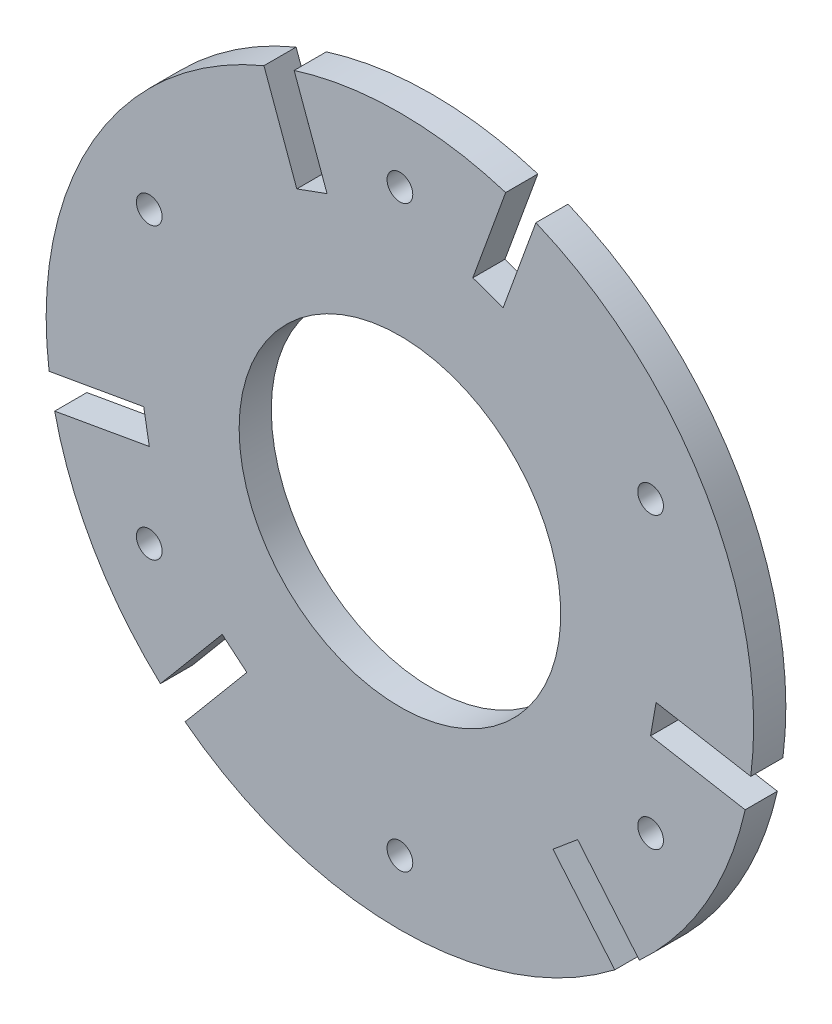
from build123d import *

# Parameters (mm, degrees)
CROQUIS1_R              = 55
SALIENTE_EXTRUIR1_DEPTH = 5
CORTAR_EXTRUIR1_DEPTH   = 78.942286341
CROQUIS3_R              = 2
CORTAR_EXTRUIR2_DEPTH   = 10
CROQUIS4_R              = 25
CORTAR_EXTRUIR3_DEPTH   = 78.942286341


with BuildPart() as part:
    # Croquis1 → Saliente-Extruir1 (new body)
    with BuildSketch(Plane.XY):
        Circle(CROQUIS1_R)
    extrude(amount=SALIENTE_EXTRUIR1_DEPTH)

    # Croquis2 → Cortar-Extruir1 (cut, through all)
    with BuildSketch(Plane.XY.offset(5)):
        Polygon((-21.161601507, 50.8315113), (-16.031299357, 36.736121988), (-11.332836253, 38.446222705), (-16.463138403, 52.541612016), align=None)
        Polygon((16.031299357, 36.736121988), (11.332836253, 38.446222705), (16.463138403, 52.541612016), (21.161601507, 50.8315113), align=None)
        Polygon((54.602180852, -7.08927116), (39.830064557, -4.484548495), (38.961823668, -9.40858726), (53.733939964, -12.013309925), align=None)
        Polygon((27.628987415, -29.037635445), (37.27080156, -40.528302091), (33.440579345, -43.74224014), (23.7987652, -32.251573493), align=None)
        Polygon((-33.440579345, -43.74224014), (-23.7987652, -32.251573493), (-27.628987415, -29.037635445), (-37.27080156, -40.528302091), align=None)
        Polygon((-38.961823668, -9.40858726), (-53.733939964, -12.013309925), (-54.602180852, -7.08927116), (-39.830064557, -4.484548495), align=None)
    extrude(amount=-CORTAR_EXTRUIR1_DEPTH, mode=Mode.SUBTRACT)

    # Croquis3 → Cortar-Extruir2 (cut)
    with BuildSketch(Plane.XY.offset(5)):
        with Locations((0, 45)):
            Circle(CROQUIS3_R)
        with Locations((0, -45)):
            Circle(CROQUIS3_R)
        with Locations((38.97114317, -22.5)):
            Circle(CROQUIS3_R)
        with Locations((-38.97114317, 22.5)):
            Circle(CROQUIS3_R)
        with Locations((-38.97114317, -22.5)):
            Circle(CROQUIS3_R)
        with Locations((38.97114317, 22.5)):
            Circle(CROQUIS3_R)
    extrude(amount=-CORTAR_EXTRUIR2_DEPTH, mode=Mode.SUBTRACT)

    # Croquis4 → Cortar-Extruir3 (cut, through all)
    with BuildSketch(Plane(origin=(0, 0, 0), x_dir=(-1, 0, 0), z_dir=(0, 0, -1))):
        Circle(CROQUIS4_R)
    extrude(amount=-CORTAR_EXTRUIR3_DEPTH, mode=Mode.SUBTRACT)


solid = part.part
